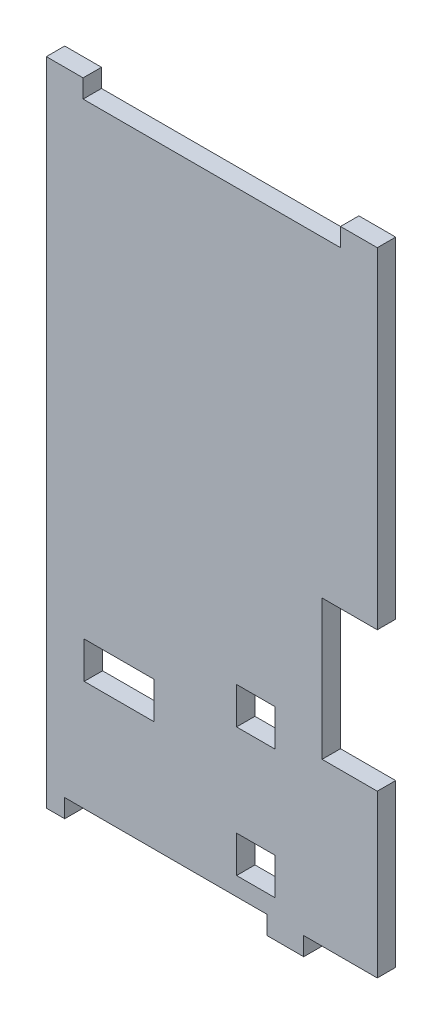
from build123d import *

# Parameters (mm, degrees)
ESQUISSE1_W        = 10.465871206
ESQUISSE1_H        = 10
ESQUISSE1_W_2      = 19.015615649
BOSS_EXTRU_1_DEPTH = 5


with BuildPart() as part:
    # Esquisse1 → Boss.-Extru.1 (new body)
    with BuildSketch(Plane.XY):
        Polygon((90, 82), (90, 167), (90, 172), (80, 172), (80, 167), (10, 167), (10, 172), (0, 172), (0, 167), (0, 0), (0, -5), (5, -5), (5, 0), (60, 0), (60, -5), (70, -5), (70, 0), (90, 0), (90, 44), (75, 44), (75, 82), align=None)
        with Locations((56.967345119, 45)):
            Rectangle(ESQUISSE1_W, ESQUISSE1_H, mode=Mode.SUBTRACT)
        with Locations((56.967345119, 10)):
            Rectangle(ESQUISSE1_W, ESQUISSE1_H, mode=Mode.SUBTRACT)
        with Locations((19.799482129, 35)):
            Rectangle(ESQUISSE1_W_2, ESQUISSE1_H, mode=Mode.SUBTRACT)
    extrude(amount=BOSS_EXTRU_1_DEPTH)


solid = part.part
